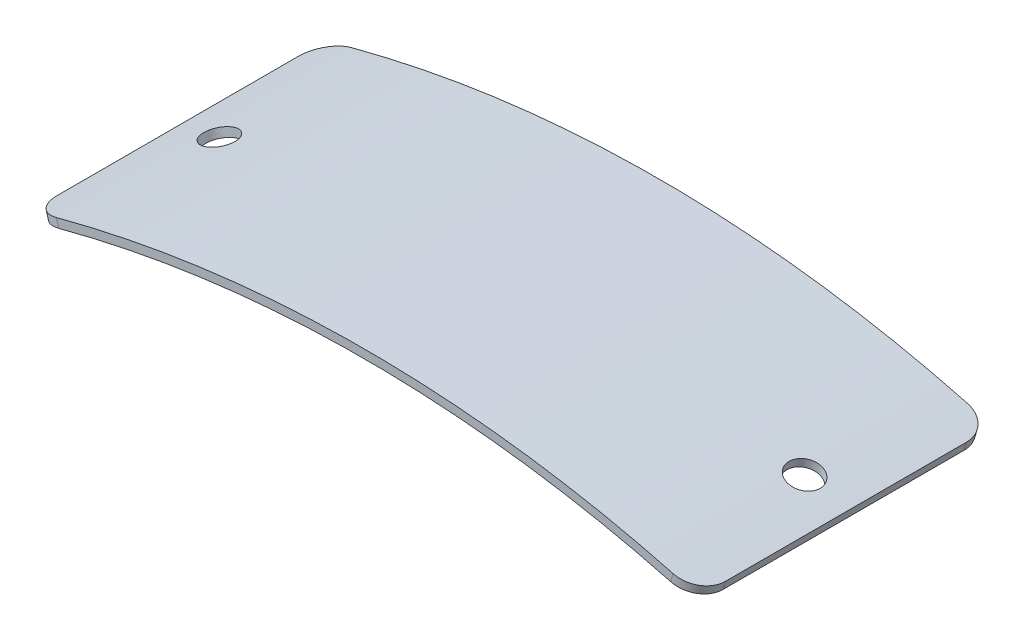
from build123d import *

# Parameters (mm, degrees)
EXTRUDE_1_DEPTH = 55
FILLET_1_R      = 5


with BuildPart() as part:
    # ｽｹｯﾁ1 → ﾎﾞｽ - 押し出し1 (new body)
    with BuildSketch(Plane.XY):
        with BuildLine():
            Line((61.949000384, 214.222597667), (62.393477517, 215.75962079))
            ThreePointArc((62.393477517, 215.75962079), (0, 224.6), (-62.393477517, 215.75962079))
            Line((-62.393477517, 215.75962079), (-61.949000384, 214.222597667))
            ThreePointArc((-61.949000384, 214.222597667), (0, 223), (61.949000384, 214.222597667))
        make_face()
    extrude(amount=EXTRUDE_1_DEPTH)

    # ﾌｨﾚｯﾄ1
    fillet_1_edges = [part.edges().sort_by_distance(p)[0] for p in [
        (-62.171238951, 214.991109229, 55),
        (-62.171238951, 214.991109229, 0),
        (62.171238951, 214.991109229, 0),
        (62.171238951, 214.991109229, 55),
    ]]
    fillet(fillet_1_edges, radius=FILLET_1_R)

    # ｽｹｯﾁ2 → ｶｯﾄ - 回転1 (revolve, cut)
    with BuildSketch(Plane.XY.offset(27.5), mode=Mode.PRIVATE) as cut_revolve_1_sk:
        Polygon((51.528577079, 205.436232793), (57.367509326, 228.715126027), (54.457647672, 229.444992558), (48.618715425, 206.166099324), align=None)
    revolve(cut_revolve_1_sk.sketch.rotate(Axis((51.528577079, 205.436232793, 27.5), (0.24328884362241038, 0.9699538847640492, 0)), 180), axis=Axis((51.528577079, 205.436232793, 27.5), (0.24328884362241038, 0.9699538847640492, 0)), mode=Mode.SUBTRACT)

    # ｽｹｯﾁ3 → ｶｯﾄ - 回転2 (revolve, cut)
    with BuildSketch(Plane.XY.offset(27.5), mode=Mode.PRIVATE) as cut_revolve_2_sk:
        Polygon((-51.528577079, 205.436232793), (-57.367509326, 228.715126027), (-60.27737098, 227.985259496), (-54.438438734, 204.706366262), align=None)
    revolve(cut_revolve_2_sk.sketch.rotate(Axis((-51.528577079, 205.436232793, 27.5), (-0.24328884362241038, 0.9699538847640492, 0)), 180), axis=Axis((-51.528577079, 205.436232793, 27.5), (-0.24328884362241038, 0.9699538847640492, 0)), mode=Mode.SUBTRACT)


solid = part.part
